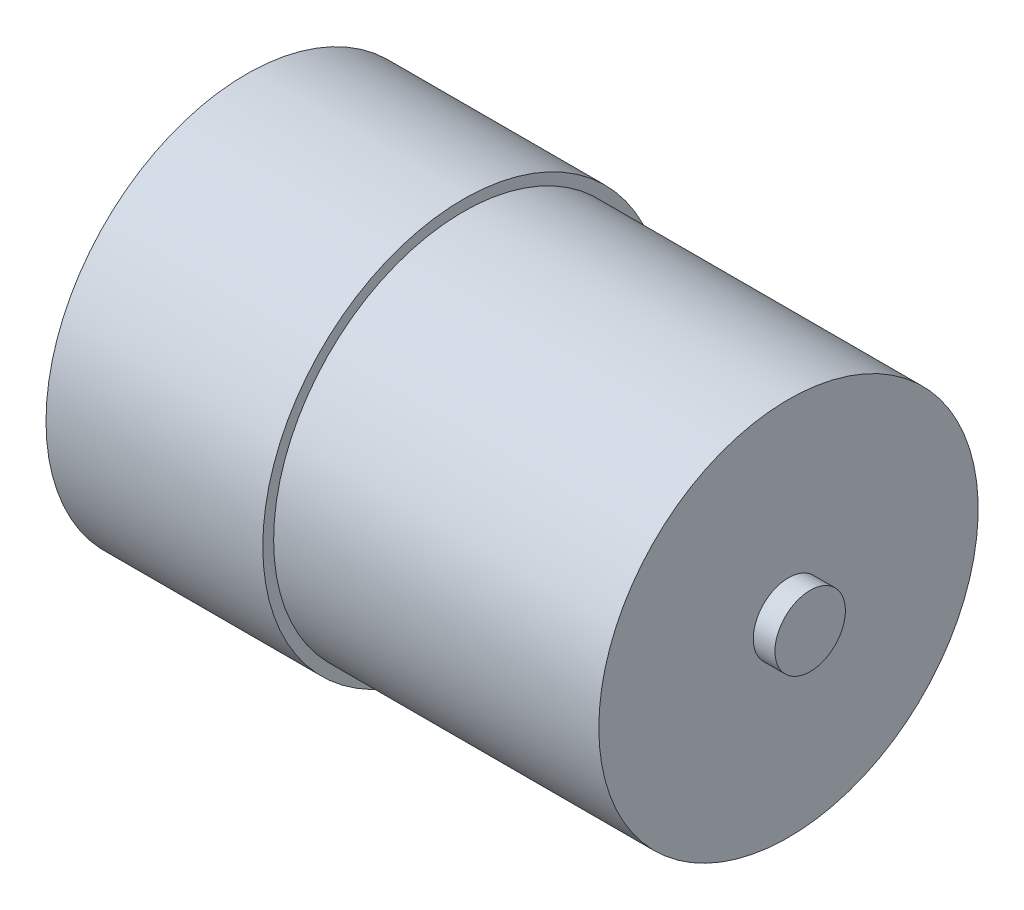
from build123d import *

# Parameters (mm, degrees)
SKETCH_2_R          = 1.5
CUT_EXTRUDE_1_DEPTH = 5
SKETCH_3_W          = 5.127083255
SKETCH_3_H          = 1.657522806
CUT_EXTRUDE_2_DEPTH = 8


with BuildPart() as part:
    # 草图1 → 旋转1 (revolve)
    with BuildSketch(Plane.XY, mode=Mode.PRIVATE) as revolve_1_sk:
        Polygon((30, 17.5), (30, 12.2), (30, 3.25), (32, 3.25), (32, 0), (30.858335085, 0), (0, 0), (-19.941664915, 0), (-22.441664915, 0), (-31.441664915, 0), (-31.441664915, 2), (-22.441664915, 2), (-22.5, 2.168145965), (-22.5, 3.5), (-20, 3.5), (-20, 18.5), (0, 18.5), (0, 17.5), align=None)
    revolve(revolve_1_sk.sketch.rotate(Axis((-72.034969576, 0, 0), (1, 0, 0)), 90), axis=Axis((-72.034969576, 0, 0), (1, 0, 0)))

    # 草图2 → 切除-拉伸1 (cut)
    with BuildSketch(Plane.ZY.offset(20)):
        with Locations((15.5, 0)):
            Circle(SKETCH_2_R)
        with Locations((7.75, -13.423393759)):
            Circle(SKETCH_2_R)
        with Locations((-7.75, -13.423393759)):
            Circle(SKETCH_2_R)
        with Locations((-15.5, 0)):
            Circle(SKETCH_2_R)
        with Locations((-7.75, 13.423393759)):
            Circle(SKETCH_2_R)
        with Locations((7.75, 13.423393759)):
            Circle(SKETCH_2_R)
    extrude(amount=-CUT_EXTRUDE_1_DEPTH, mode=Mode.SUBTRACT)

    # 草图3 → 切除-拉伸2 (cut)
    with BuildSketch(Plane.ZY.offset(31.441664915)):
        with Locations((0.013848215, 2.328761403)):
            Rectangle(SKETCH_3_W, SKETCH_3_H)
    extrude(amount=-CUT_EXTRUDE_2_DEPTH, mode=Mode.SUBTRACT)


solid = part.part
